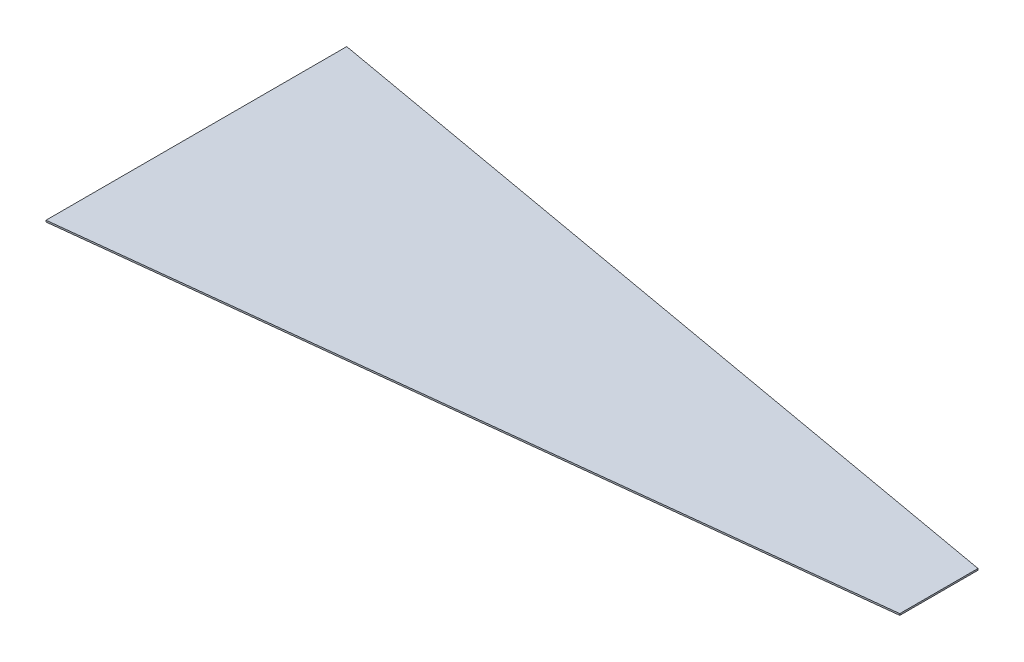
from build123d import *

# Parameters (mm, degrees)
BOSS_EXTRUDE1_DEPTH = 2.54


with BuildPart() as part:
    # Sketch1 → Boss-Extrude1 (new body)
    with BuildSketch(Plane(origin=(0, 0, 0), x_dir=(1, 0, 0), z_dir=(0, 1, 0))):
        Polygon((0, -241.3), (0, 241.3), (1231.9, 22.541092576), (1231.9, -102.934907424), align=None)
    extrude(amount=BOSS_EXTRUDE1_DEPTH)


solid = part.part
